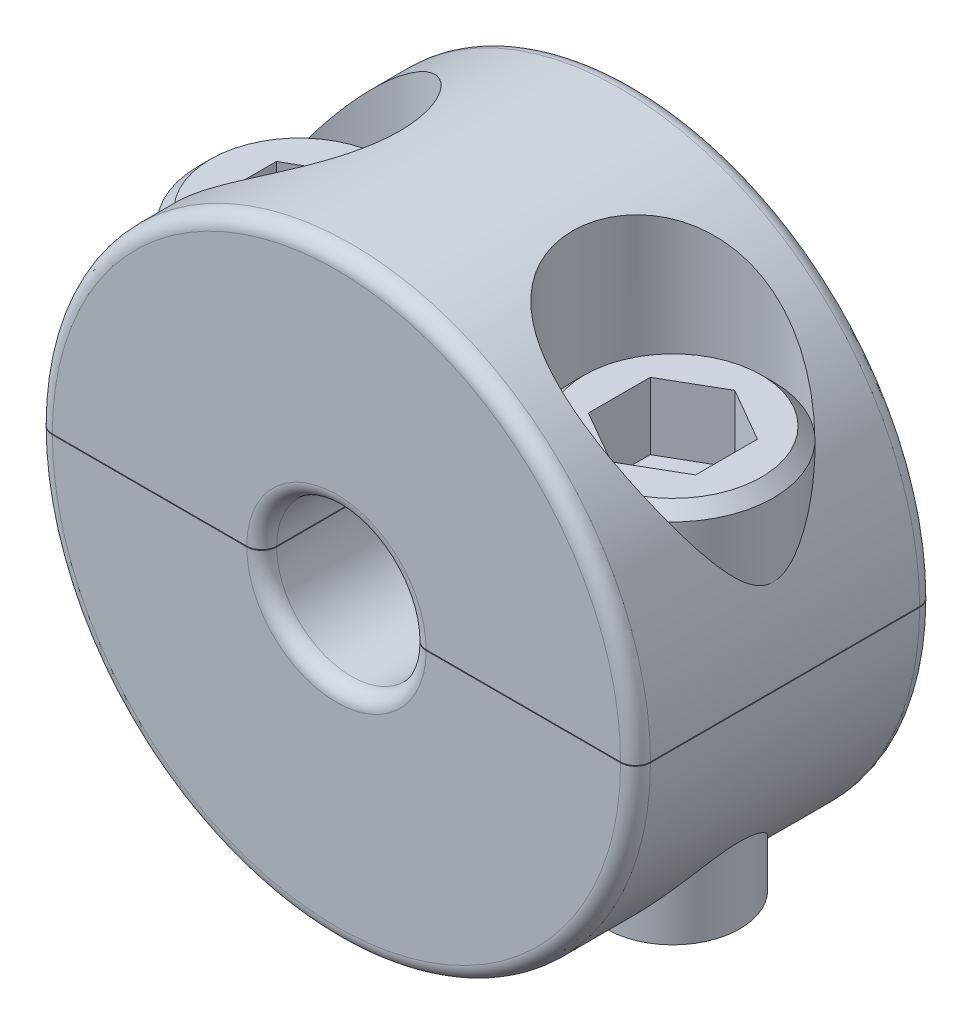
from build123d import *

# Parameters (mm, degrees)
EXTRUDE1_DEPTH     = 3.175
EXTRUDE1_2_DEPTH   = 3.175
CUT_EXTRUDE2_DEPTH = 1.4224
FILLET1_R          = 0.3175
FILLET2_R          = 0.3175
CHAMFER1_SIZE      = 0.254
CHAMFER2_SIZE      = 0.254


with BuildPart() as part:
    # Sketch1 → Extrude1 (new, symmetric)
    with BuildSketch(Plane.XY):
        with BuildLine():
            Line((-6.35, 0.0079375), (-1.5875, 0.0079375))
            ThreePointArc((-1.5875, 0.0079375), (0, 1.5954375), (1.5875, 0.0079375))
            Line((1.5875, 0.0079375), (6.35, 0.0079375))
            ThreePointArc((6.35, 0.0079375), (0, 6.3579375), (-6.35, 0.0079375))
        make_face()
    extrude(amount=EXTRUDE1_DEPTH, both=True)


with BuildPart() as body_2:
    # Sketch1 → Extrude1 2 (new, symmetric)
    with BuildSketch(Plane.XY):
        with BuildLine():
            Line((-6.35, -0.0079375), (-1.5875, -0.0079375))
            ThreePointArc((-1.5875, -0.0079375), (0, -1.5954375), (1.5875, -0.0079375))
            Line((1.5875, -0.0079375), (6.35, -0.0079375))
            ThreePointArc((6.35, -0.0079375), (0, -6.3579375), (-6.35, -0.0079375))
        make_face()
    extrude(amount=EXTRUDE1_2_DEPTH, both=True)


with BuildPart() as cut_revolve1_tool:
    # Sketch4 → Cut-Revolve1 (revolve)
    with BuildSketch(Plane.XY):
        Polygon((-3.96875, 6.3579375), (-1.83515, 6.3579375), (-1.83515, 0.7191375), (-2.54635, 0.7191375), (-2.54635, -6.3579375), (-3.96875, -6.3579375), align=None)
    cut_revolve1 = revolve(axis=Axis((-3.96875, -6.3579375, 0), (0, 1, 0)))


with BuildPart() as part_1:
    add(part.part)

    # Cut-Revolve1: cut by cut_revolve1_tool
    add(cut_revolve1_tool.part, mode=Mode.SUBTRACT)


with BuildPart() as body_2_1:
    add(body_2.part)

    # Cut-Revolve1: cut by cut_revolve1_tool
    add(cut_revolve1_tool.part, mode=Mode.SUBTRACT)


with BuildPart() as body_3:
    # Sketch6 → Revolve1 (revolve)
    with BuildSketch(Plane.XY):
        Polygon((-3.96875, 3.5639375), (-1.83515, 3.5639375), (-1.83515, 0.7191375), (-2.54635, 0.7191375), (-2.54635, -4.9704625), (-3.96875, -4.9704625), align=None)
    revolve(axis=Axis((-3.96875, -4.9704625, 0), (0, 1, 0)))

    # Sketch7 → Cut-Extrude2 (cut)
    with BuildSketch(Plane(origin=(0, 3.5639375, 0), x_dir=(-1, 0, 0), z_dir=(0, 1, 0))):
        Polygon((3.96875, -1.313956837), (5.10667, -0.656978418), (5.10667, 0.656978418), (3.96875, 1.313956837), (2.83083, 0.656978418), (2.83083, -0.656978418), align=None)
    extrude(amount=-CUT_EXTRUDE2_DEPTH, mode=Mode.SUBTRACT)


with BuildPart() as mirror1_tool:
    # Mirror1: Cut-Revolve1 across plane
    add(cut_revolve1.mirror(Plane(origin=(0, 0, 0), x_dir=(0, 0, 1), z_dir=(1, 0, 0))))


with BuildPart() as part_2:
    add(part_1.part)

    # Mirror1: cut by mirror1_tool
    add(mirror1_tool.part, mode=Mode.SUBTRACT)

    # Fillet1
    fillet1_edges = [part_2.edges().sort_by_distance(p)[0] for p in [
        (0, 6.3579375, -3.175),
        (0, 6.3579375, 3.175),
        (0, 1.5954375, -3.175),
        (0, 1.5954375, 3.175),
    ]]
    fillet(fillet1_edges, radius=FILLET1_R)


with BuildPart() as body_2_2:
    add(body_2_1.part)

    # Mirror1: cut by mirror1_tool
    add(mirror1_tool.part, mode=Mode.SUBTRACT)

    # Fillet2
    fillet2_edges = [body_2_2.edges().sort_by_distance(p)[0] for p in [
        (0, -6.3579375, -3.175),
        (0, -6.3579375, 3.175),
        (0, -1.5954375, -3.175),
        (0, -1.5954375, 3.175),
    ]]
    fillet(fillet2_edges, radius=FILLET2_R)


with BuildPart() as body_4:
    # Mirror2: mirrored copy
    add(body_3.part.mirror(Plane(origin=(0, 0, 0), x_dir=(0, 0, 1), z_dir=(1, 0, 0))))

    # Chamfer2
    chamfer2_edges = [body_4.edges().sort_by_distance(p)[0] for p in [
        (6.10235, 3.5639375, 0),
    ]]
    chamfer(chamfer2_edges, length=CHAMFER2_SIZE)


with BuildPart() as body_3_1:
    add(body_3.part)

    # Chamfer1
    chamfer1_edges = [body_3_1.edges().sort_by_distance(p)[0] for p in [
        (-6.10235, 3.5639375, 0),
    ]]
    chamfer(chamfer1_edges, length=CHAMFER1_SIZE)


solid = Compound([part_2.part, body_2_2.part, body_4.part, body_3_1.part])
